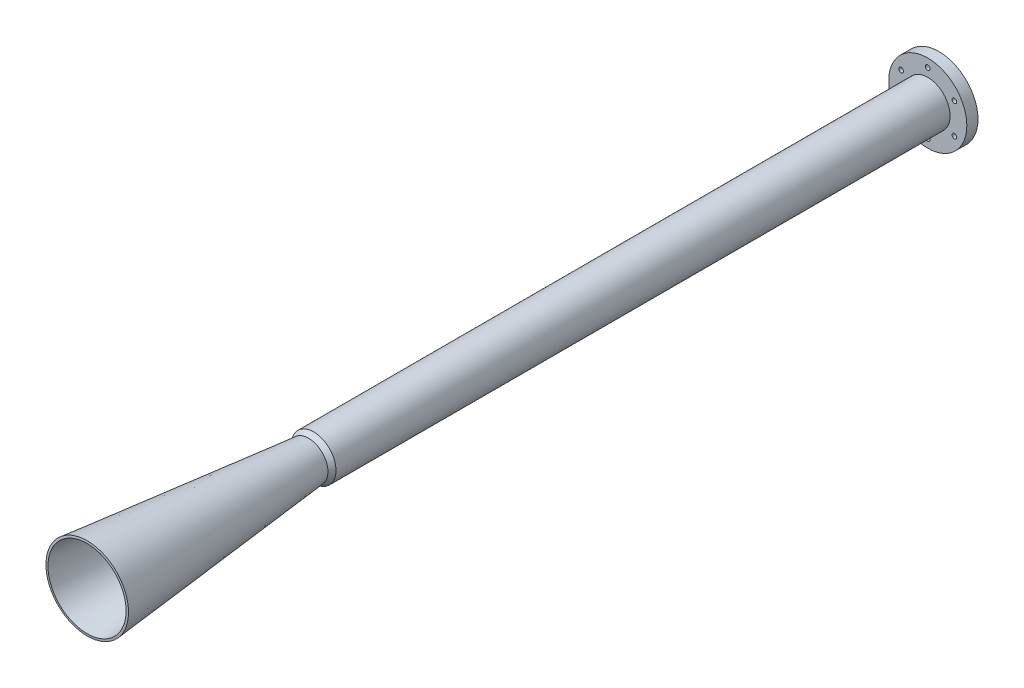
from build123d import *

# Parameters (mm, degrees)
HOLE_WIZARD_M51_D     = 4.2
HOLE_WIZARD_M51_DEPTH = 10


with BuildPart() as part:
    # Эскиз2 → Повернуть-Тонкостенный3 (revolve)
    with BuildSketch(Plane(origin=(0, 0, 0), x_dir=(0, 0, -1), z_dir=(1, 0, 0)), mode=Mode.PRIVATE) as revolve_3_sk:
        Polygon((-753, 35), (-450, 5), (-399, 5), (0, 5), (0, 7), (-399, 7), (-449.901231564, 7), (-752.80294371, 36.990268529), align=None)
    revolve(revolve_3_sk.sketch.rotate(Axis((0, 0, 1181.729856139), (0, 0, -1)), 90), axis=Axis((0, 0, 1181.729856139), (0, 0, -1)))

    # Эскиз8 → Повернуть1 (revolve)
    with BuildSketch(Plane(origin=(0, 0, 0), x_dir=(0, 0, -1), z_dir=(1, 0, 0)), mode=Mode.PRIVATE) as revolve_1_sk:
        Polygon((0, 5), (0, 35), (10, 35), (10, 15), (10, 5), align=None)
    revolve(revolve_1_sk.sketch.rotate(Axis((0, 0, 1181.729856139), (0, 0, -1)), 90), axis=Axis((0, 0, 1181.729856139), (0, 0, -1)))

    # Эскиз10 → Повернуть-Тонкостенный6 (revolve)
    with BuildSketch(Plane(origin=(0, 0, 0), x_dir=(0, 0, -1), z_dir=(1, 0, 0)), mode=Mode.PRIVATE) as revolve_6_sk:
        Polygon((0, 20), (-550, 20), (-554.567434607, 17.3629904), (-553.567434607, 15.630939593), (-549.464101615, 18), (0, 18), align=None)
    revolve(revolve_6_sk.sketch.rotate(Axis((0, 0, -54.408578324), (0, 0, 1)), 90), axis=Axis((0, 0, -54.408578324), (0, 0, 1)))

    # Отверстие обработанное метчиком M51
    with Locations(Plane.XY):
        with Locations((-23.815698604, 13.75), (0, 27.5), (23.815698604, 13.75), (23.815698604, -13.75), (-23.815698604, -13.75), (0, -27.5)):
            Hole(HOLE_WIZARD_M51_D / 2, depth=HOLE_WIZARD_M51_DEPTH)


solid = part.part
